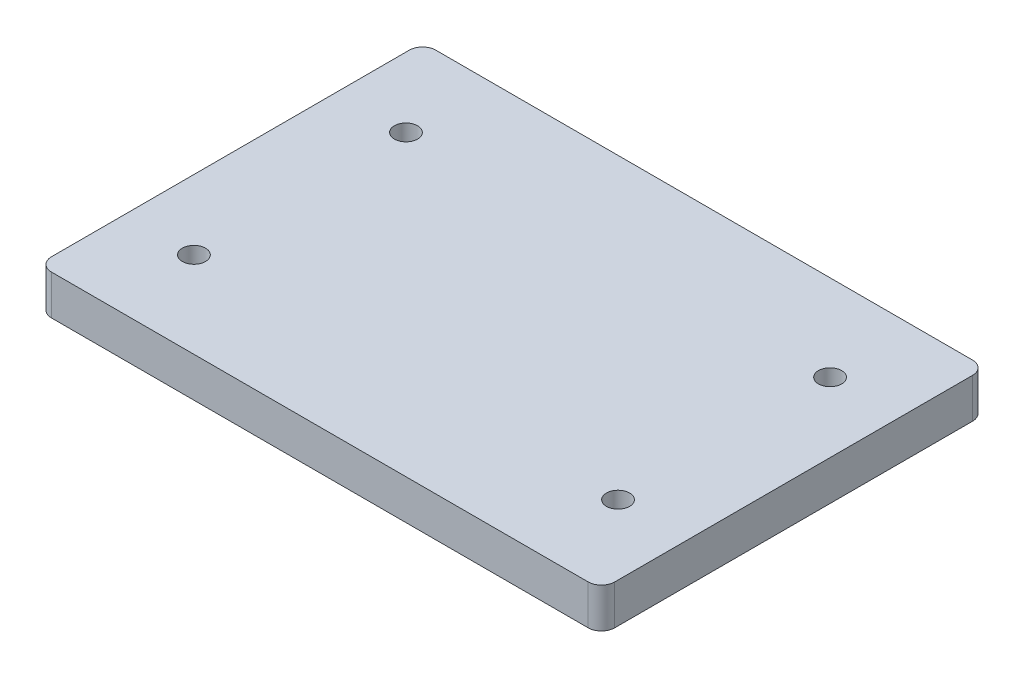
from build123d import *

# Parameters (mm, degrees)
SKETCH_1_W          = 85
SKETCH_1_H          = 58
EXTRUDE_1_DEPTH     = 6
FILLET_1_R          = 2
SKETCH_2_R          = 1.75
CUT_EXTRUDE_1_DEPTH = 6


with BuildPart() as part:
    # 草图1 → 凸台-拉伸1 (new body)
    with BuildSketch(Plane(origin=(0, 0, 0), x_dir=(1, 0, 0), z_dir=(0, 1, 0))):
        Rectangle(SKETCH_1_W, SKETCH_1_H)
    extrude(amount=EXTRUDE_1_DEPTH)

    # 圆角1
    fillet_1_edges = [part.edges().sort_by_distance(p)[0] for p in [
        (42.5, 3, 29),
        (-42.5, 3, 29),
        (-42.5, 3, -29),
        (42.5, 3, -29),
    ]]
    fillet(fillet_1_edges, radius=FILLET_1_R)

    # 草图2 → 切除-拉伸1 (cut)
    with BuildSketch(Plane(origin=(0, 6, 0), x_dir=(1, 0, 0), z_dir=(0, 1, 0))):
        with Locations(Location((-32, 16, 0), (0, 0, 270))):
            Circle(SKETCH_2_R)
        with Locations(Location((32, 16, 0), (0, 0, 90))):
            Circle(SKETCH_2_R)
        with Locations(Location((32, -16, 0), (0, 0, 270))):
            Circle(SKETCH_2_R)
        with Locations(Location((-32, -16, 0), (0, 0, 90))):
            Circle(SKETCH_2_R)
    extrude(amount=-CUT_EXTRUDE_1_DEPTH, mode=Mode.SUBTRACT)


solid = part.part
